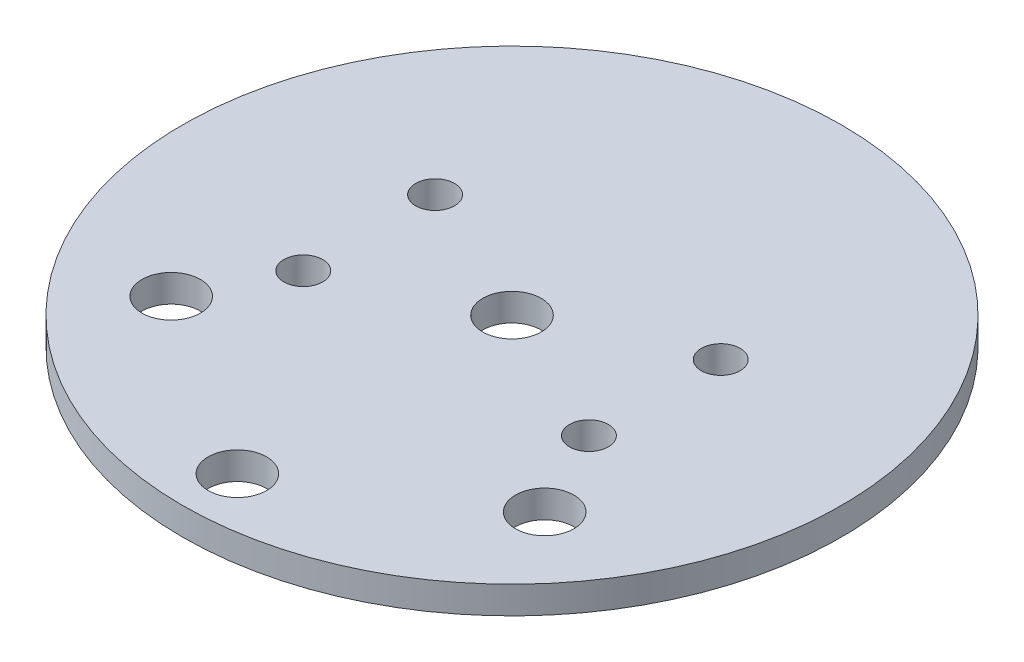
from build123d import *

# Parameters (mm, degrees)
SKETCH1_R               = 38.1
BOSS_EXTRUDE1_DEPTH     = 1.5875
F_1_4_CLEARANCE_HOLE1_D = 6.7564
F_1_4_CLEARANCE_HOLE2_D = 6.7564
F_1_4_CLEARANCE_HOLE3_D = 6.7564
F_8_CLEARANCE_HOLE1_D   = 4.4958


with BuildPart() as part:
    # Sketch1 → Boss-Extrude1 (new, symmetric)
    with BuildSketch(Plane(origin=(0, 0, 0), x_dir=(1, 0, 0), z_dir=(0, 1, 0))):
        with Locations(Location((0, 0, 0), (0, 0, 270))):
            Circle(SKETCH1_R)
    extrude(amount=BOSS_EXTRUDE1_DEPTH, both=True)

    # 1/4 Clearance Hole1 (through all)
    with Locations(Plane(origin=(0, 1.5875, 0), x_dir=(1, 0, 0), z_dir=(0, 1, 0))):
        with Locations((-21.59, -17.810706314), (21.59, -17.810706314)):
            Hole(F_1_4_CLEARANCE_HOLE1_D / 2)

    # 1/4 Clearance Hole2 (through all)
    with Locations(Plane(origin=(0, 1.5875, 0), x_dir=(1, 0, 0), z_dir=(0, 1, 0))):
        with Locations((0, 0)):
            Hole(F_1_4_CLEARANCE_HOLE2_D / 2)

    # 1/4 Clearance Hole3 (through all)
    with Locations(Plane(origin=(0, 1.5875, 0), x_dir=(1, 0, 0), z_dir=(0, 1, 0))):
        with Locations((0, -31.75)):
            Hole(F_1_4_CLEARANCE_HOLE3_D / 2)

    # #8 Clearance Hole1 (through all)
    with Locations(Plane(origin=(0, 1.5875, 0), x_dir=(1, 0, 0), z_dir=(0, 1, 0))):
        with Locations((-16.51, 7.62), (-16.51, -7.62), (16.51, -7.62), (16.51, 7.62)):
            Hole(F_8_CLEARANCE_HOLE1_D / 2)


solid = part.part
